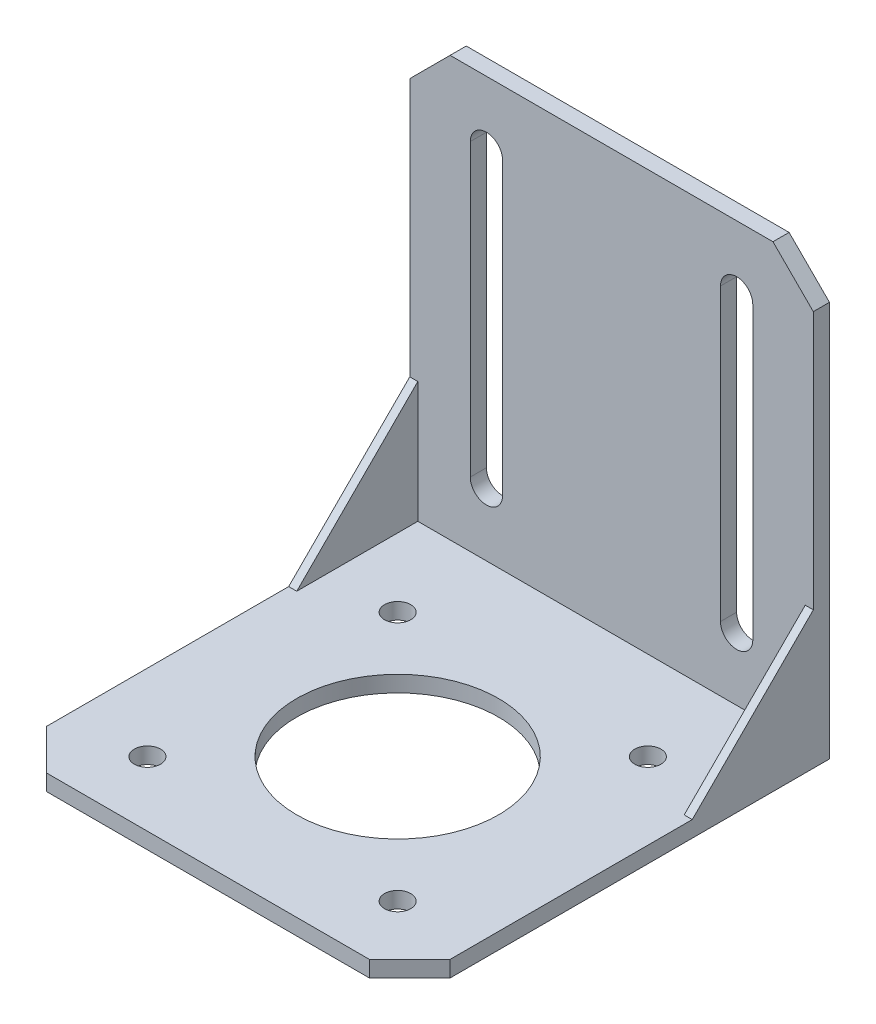
from build123d import *

# Parameters (mm, degrees)
BOSS_EXTRUDE1_DEPTH = 50
CHAMFER1_SIZE       = 5
SKETCH2_R           = 1.625
SKETCH2_R_2         = 12.5
CUT_EXTRUDE1_DEPTH  = 77.681158051
CUT_EXTRUDE2_DEPTH  = 89.971905678
BOSS_EXTRUDE2_DEPTH = 1
BOSS_EXTRUDE3_START = -50
BOSS_EXTRUDE3_DEPTH = 1


with BuildPart() as part:
    # Sketch1 → Boss-Extrude1 (new body)
    with BuildSketch(Plane(origin=(0, 0, 0), x_dir=(0, 0, -1), z_dir=(1, 0, 0))):
        Polygon((-26, 0), (26, 0), (26, 54), (24, 54), (24, 2), (-26, 2), align=None)
    extrude(amount=-BOSS_EXTRUDE1_DEPTH)

    # Chamfer1
    chamfer1_edges = [part.edges().sort_by_distance(p)[0] for p in [
        (-50, 54, -25),
        (-50, 1, 26),
        (0, 54, -25),
        (0, 1, 26),
    ]]
    chamfer(chamfer1_edges, length=CHAMFER1_SIZE)

    # Sketch2 → Cut-Extrude1 (cut, through all)
    with BuildSketch(Plane(origin=(0, 2, 0), x_dir=(1, 0, 0), z_dir=(0, 1, 0))):
        with Locations(Location((-40.5, 13, 0), (0, 0, 270))):
            Circle(SKETCH2_R)
        with Locations(Location((-9.5, 13, 0), (0, 0, 90))):
            Circle(SKETCH2_R)
        with Locations(Location((-9.5, -18, 0), (0, 0, 270))):
            Circle(SKETCH2_R)
        with Locations(Location((-40.5, -18, 0), (0, 0, 90))):
            Circle(SKETCH2_R)
        with Locations(Location((-25, -2.5, 0), (0, 0, 270))):
            Circle(SKETCH2_R_2)
    extrude(amount=-CUT_EXTRUDE1_DEPTH, mode=Mode.SUBTRACT)

    # Sketch3 → Cut-Extrude2 (cut, through all)
    with BuildSketch(Plane.XY.offset(-24)):
        with BuildLine():
            Line((-38.5, 46), (-38.5, 10))
            ThreePointArc((-38.5, 10), (-40.5, 8), (-42.5, 10))
            Line((-42.5, 10), (-42.5, 46))
            ThreePointArc((-42.5, 46), (-40.5, 48), (-38.5, 46))
        make_face()
        with BuildLine():
            Line((-11.5, 46), (-11.5, 10))
            ThreePointArc((-11.5, 10), (-9.5, 8), (-7.5, 10))
            Line((-7.5, 10), (-7.5, 46))
            ThreePointArc((-7.5, 46), (-9.5, 48), (-11.5, 46))
        make_face()
    extrude(amount=-CUT_EXTRUDE2_DEPTH, mode=Mode.SUBTRACT)

    # Sketch4 → Boss-Extrude2 (add)
    with BuildSketch(Plane(origin=(0, 0, 0), x_dir=(0, 0, -1), z_dir=(1, 0, 0))):
        Polygon((9, 2), (24, 2), (24, 17), align=None)
    extrude(amount=-BOSS_EXTRUDE2_DEPTH)

    # Sketch4<2> → Boss-Extrude3 (add)
    with BuildSketch(Plane(origin=(0, 0, 0), x_dir=(0, 0, -1), z_dir=(1, 0, 0)).offset(BOSS_EXTRUDE3_START)):
        Polygon((9, 2), (24, 2), (24, 17), align=None)
    extrude(amount=BOSS_EXTRUDE3_DEPTH)


solid = part.part
